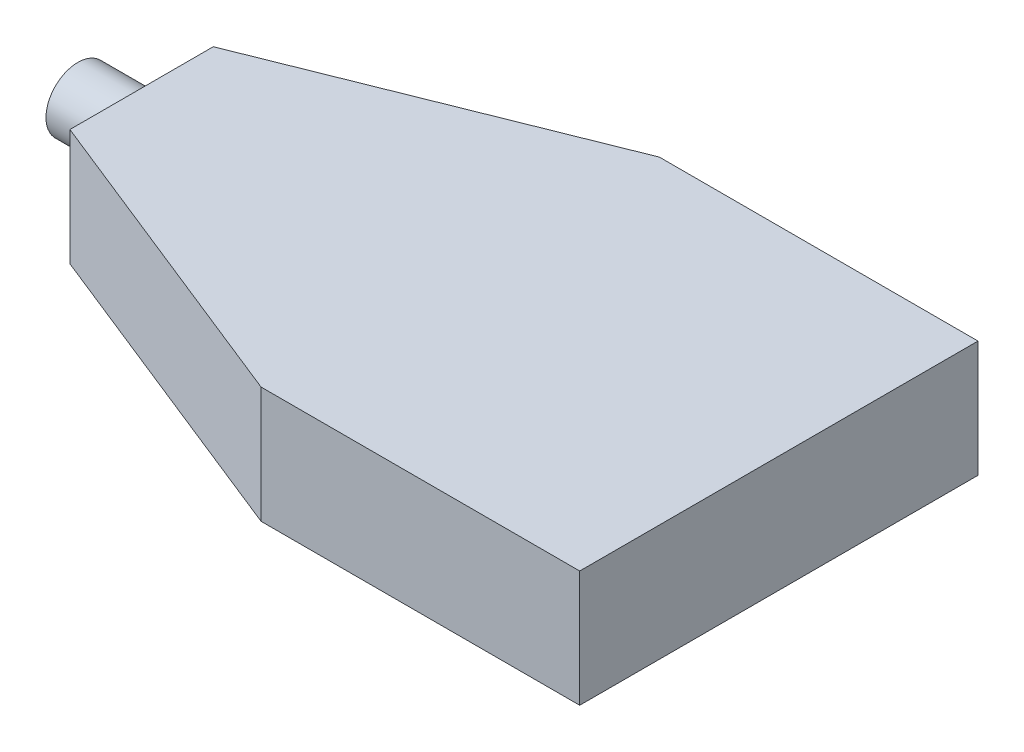
from build123d import *

# Parameters (mm, degrees)
SKETCH1_W           = 100
SKETCH1_H           = 125
BOSS_EXTRUDE1_DEPTH = 36.5
SKETCH27_R          = 10
BOSS_EXTRUDE2_DEPTH = 20
SKETCH28_R          = 9.1
CUT_EXTRUDE11_DEPTH = 20


with BuildPart() as part:
    # Sketch1 → Boss-Extrude1 (new body)
    with BuildSketch(Plane(origin=(0, 0, 0), x_dir=(1, 0, 0), z_dir=(0, 1, 0))):
        Polygon((-150, 22.5), (-150, -22.5), (-50, -62.5), (-50, 62.5), align=None)
        Rectangle(SKETCH1_W, SKETCH1_H)
    extrude(amount=BOSS_EXTRUDE1_DEPTH)

    # Sketch27 → Boss-Extrude2 (add)
    with BuildSketch(Plane.ZY.offset(150)):
        with Locations((0, 23.5)):
            Circle(SKETCH27_R)
    extrude(amount=BOSS_EXTRUDE2_DEPTH)

    # Sketch28 → Cut-Extrude11 (cut)
    with BuildSketch(Plane.ZY.offset(170)):
        with Locations((0, 23.5)):
            Circle(SKETCH28_R)
    extrude(amount=-CUT_EXTRUDE11_DEPTH, mode=Mode.SUBTRACT)


solid = part.part
